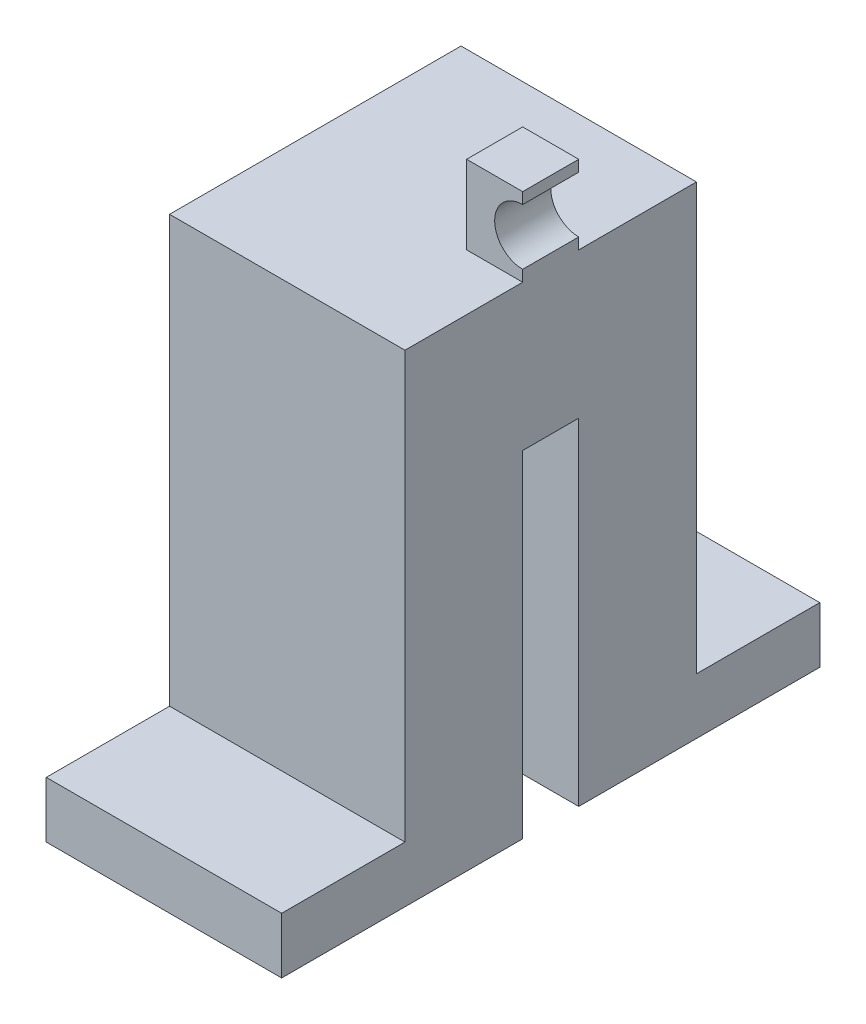
from build123d import *

# Parameters (mm, degrees)
EXTRUDE_1_DEPTH          = 50
SKETCH_3_W               = 8
SKETCH_3_H               = 7
CUT_EXTRUDE_1_DEPTH      = 31.389642439
CUT_EXTRUDE_2_DEPTH      = 55.893077888
CUT_EXTRUDE_2_DEPTH_BACK = 30
SKETCH_15_W              = 6
SKETCH_15_H              = 7
CUT_EXTRUDE_10_DEPTH     = 30
SKETCH_16_W              = 16
SKETCH_16_H              = 7
SKETCH_16_W_2            = 6.921662606
CUT_EXTRUDE_11_DEPTH     = 30
SKETCH_18_R              = 2.5
CUT_EXTRUDE_12_DEPTH     = 30
SKETCH_19_W              = 21
SKETCH_19_H              = 3
CUT_EXTRUDE_14_DEPTH     = 50
SKETCH_20_W              = 4
SKETCH_20_H              = 6.019641958
CUT_EXTRUDE_16_DEPTH     = 50
EXTRUDE_START            = -43
SKETCH_21_W              = 21
SKETCH_21_H              = 7.5
EXTRUDE_3_DEPTH          = 43
SKETCH_22_W              = 21
SKETCH_22_H              = 5
EXTRUDE_4_DEPTH          = 11
SKETCH_23_W              = 21
SKETCH_23_H              = 5
EXTRUDE_5_DEPTH          = 11


with BuildPart() as part:
    # 草图1 → 凸台-拉伸1 (new body)
    with BuildSketch(Plane(origin=(0, 0, 0), x_dir=(1, 0, 0), z_dir=(0, 1, 0))):
        Polygon((0, -8.5), (0, -1), (-2, -1), (-2, -3), (-4, -3), (-4, 3), (-2, 3), (-2, 1), (0, 1), (0, 8.5), (21, 8.5), (21, -8.5), align=None)
    extrude(amount=EXTRUDE_1_DEPTH)

    # 草图3 → 切除-拉伸1 (cut)
    with BuildSketch(Plane.XZ):
        with Locations((7, 0)):
            Rectangle(SKETCH_3_W, SKETCH_3_H)
    extrude(amount=-CUT_EXTRUDE_1_DEPTH, mode=Mode.SUBTRACT)

    # 草图6 → 切除-拉伸2 (cut, two sides: drawn at the far end of the back side and taken through both)
    with BuildSketch(Plane.XZ.offset(-CUT_EXTRUDE_2_DEPTH_BACK)):
        Polygon((21, -2.405859061), (21, 0), (21, 2.5), (14, 2.5), (14, -2.5), (21, -2.5), align=None)
    extrude(amount=CUT_EXTRUDE_2_DEPTH + CUT_EXTRUDE_2_DEPTH_BACK, mode=Mode.SUBTRACT)

    # 草图15 → 切除-拉伸10 (cut)
    with BuildSketch(Plane(origin=(21, 0, 0), x_dir=(0, 0, -1), z_dir=(1, 0, 0))):
        with Locations((-5.5, 46.5)):
            Rectangle(SKETCH_15_W, SKETCH_15_H)
        with Locations((5.5, 46.5)):
            Rectangle(SKETCH_15_W, SKETCH_15_H)
    extrude(amount=-CUT_EXTRUDE_10_DEPTH, mode=Mode.SUBTRACT)

    # 草图16 → 切除-拉伸11 (cut)
    with BuildSketch(Plane.XY.offset(2.5)):
        with Locations((8, 46.5)):
            Rectangle(SKETCH_16_W, SKETCH_16_H)
        with Locations((-3.460831303, 46.5)):
            Rectangle(SKETCH_16_W_2, SKETCH_16_H)
    extrude(amount=-CUT_EXTRUDE_11_DEPTH, mode=Mode.SUBTRACT)

    # 草图18 → 切除-拉伸12 (cut)
    with BuildSketch(Plane(origin=(0, 0, -2.5), x_dir=(-1, 0, 0), z_dir=(0, 0, -1))):
        with Locations((-21, 46.5)):
            Circle(SKETCH_18_R)
    extrude(amount=-CUT_EXTRUDE_12_DEPTH, mode=Mode.SUBTRACT)

    # 草图19 → 切除-拉伸14 (cut)
    with BuildSketch(Plane(origin=(0, 0, 0), x_dir=(-1, 0, 0), z_dir=(0, -1, 0))):
        with Locations((-10.5, -7)):
            Rectangle(SKETCH_19_W, SKETCH_19_H)
        with Locations((-10.5, 7)):
            Rectangle(SKETCH_19_W, SKETCH_19_H)
    extrude(amount=-CUT_EXTRUDE_14_DEPTH, mode=Mode.SUBTRACT)

    # 草图20 → 切除-拉伸16 (cut)
    with BuildSketch(Plane.XZ):
        with Locations((-2, -0.009820979)):
            Rectangle(SKETCH_20_W, SKETCH_20_H)
    extrude(amount=-CUT_EXTRUDE_16_DEPTH, mode=Mode.SUBTRACT)

    # 草图21 → 凸台-拉伸3 (add)
    with BuildSketch(Plane.XZ.offset(EXTRUDE_START)):
        with Locations((10.5, -9.25)):
            Rectangle(SKETCH_21_W, SKETCH_21_H)
        with Locations((10.5, 9.25)):
            Rectangle(SKETCH_21_W, SKETCH_21_H)
    extrude(amount=EXTRUDE_3_DEPTH)

    # 草图22 → 凸台-拉伸4 (add)
    with BuildSketch(Plane.XY.offset(13)):
        with Locations((10.5, 2.5)):
            Rectangle(SKETCH_22_W, SKETCH_22_H)
    extrude(amount=EXTRUDE_4_DEPTH)

    # 草图23 → 凸台-拉伸5 (add)
    with BuildSketch(Plane(origin=(0, 0, -13), x_dir=(-1, 0, 0), z_dir=(0, 0, -1))):
        with Locations((-10.5, 2.5)):
            Rectangle(SKETCH_23_W, SKETCH_23_H)
    extrude(amount=EXTRUDE_5_DEPTH)


solid = part.part
